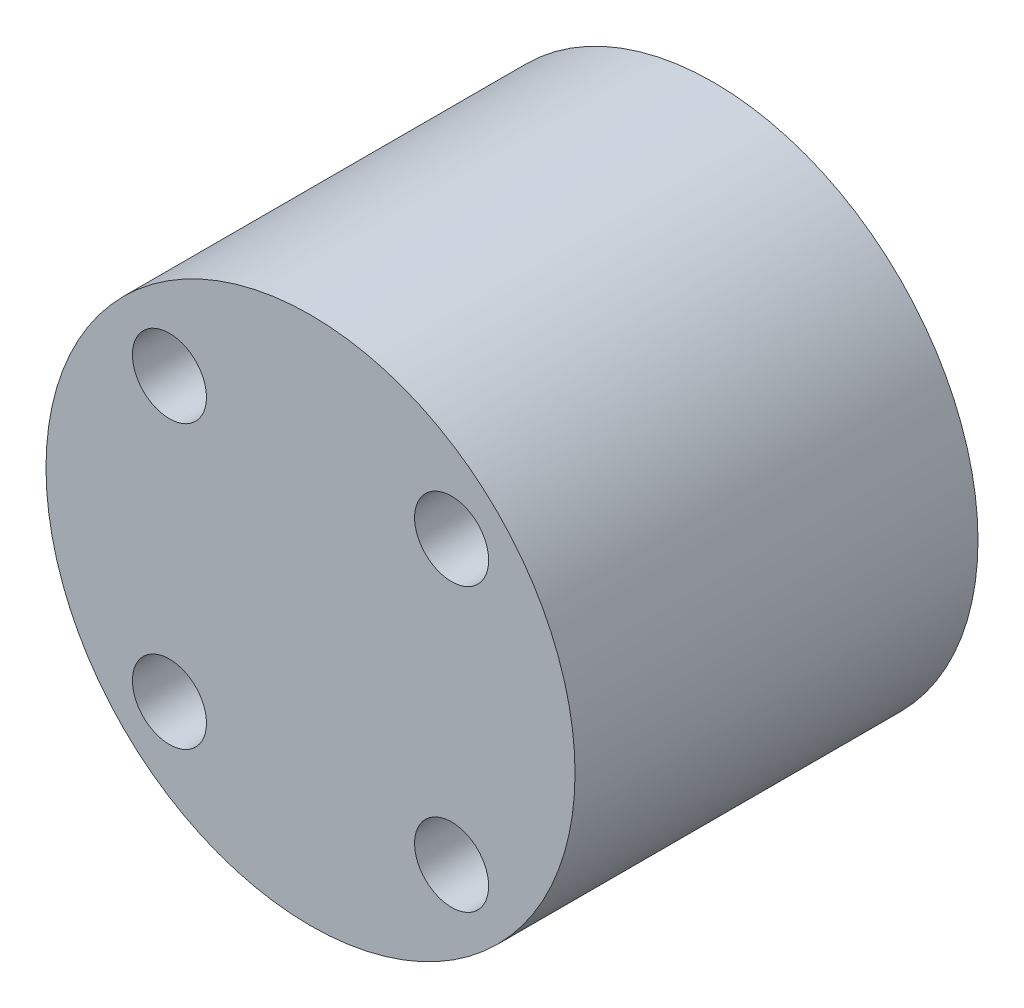
from build123d import *

# Parameters (mm, degrees)
SKETCH1_R           = 15
BOSS_EXTRUDE1_DEPTH = 11.425
SKETCH2_R           = 2.1
CUT_EXTRUDE1_DEPTH  = 32.178879069


with BuildPart() as part:
    # Sketch1 → Boss-Extrude1 (new, symmetric)
    with BuildSketch(Plane.XY):
        with Locations(Location((0, 0, 0), (0, 0, 180))):
            Circle(SKETCH1_R)
    extrude(amount=BOSS_EXTRUDE1_DEPTH, both=True)

    # Sketch2 → Cut-Extrude1 (cut, through all)
    with BuildSketch(Plane.XY.offset(11.425)):
        with Locations((-8, 8)):
            Circle(SKETCH2_R)
        with Locations((8, 8)):
            Circle(SKETCH2_R)
        with Locations((8, -8)):
            Circle(SKETCH2_R)
        with Locations((-8, -8)):
            Circle(SKETCH2_R)
    extrude(amount=-CUT_EXTRUDE1_DEPTH, mode=Mode.SUBTRACT)


solid = part.part
